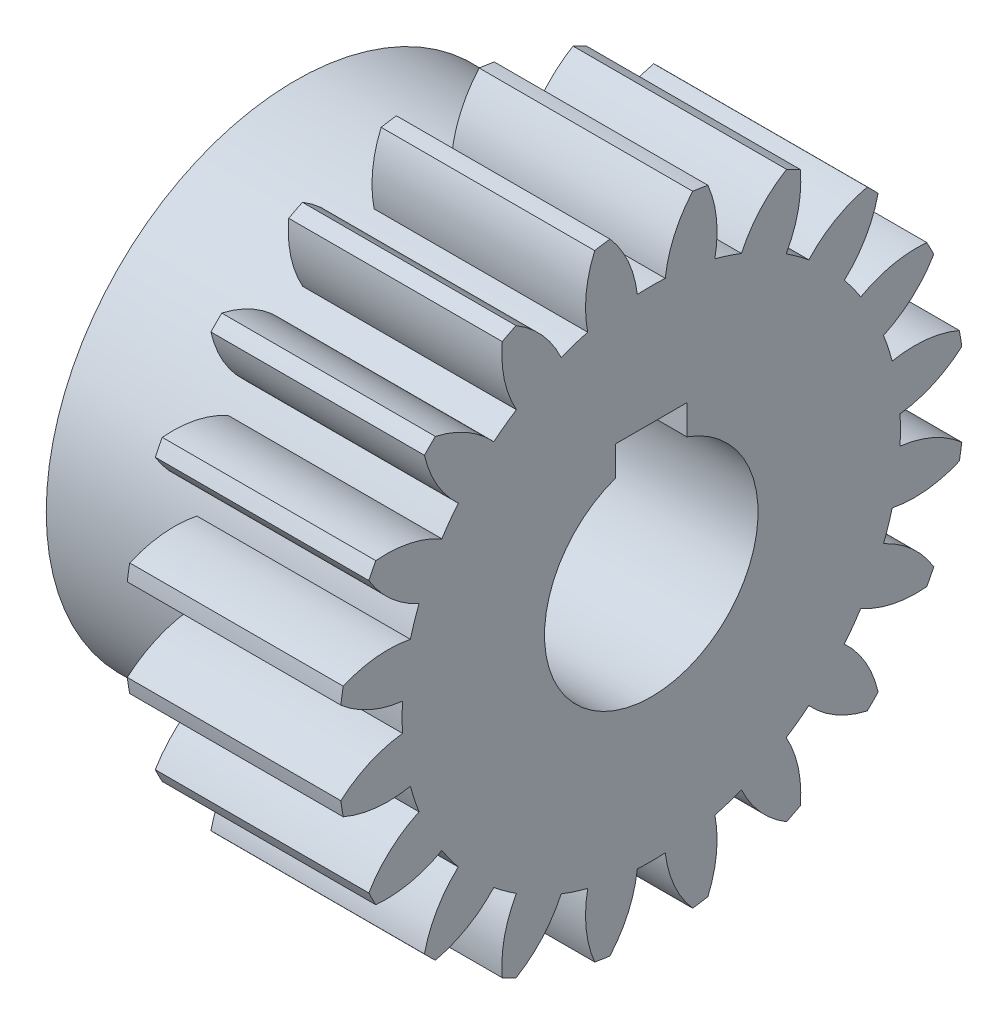
from build123d import *
from build123d.topology import SkipClean

# Parameters (mm, degrees)
BASPROSKE_W      = 30
BASPROSKE_H      = 44
TOOTHCUT_DEPTH   = 70.079664157
TEETHCUTS_COUNT  = 20
TEETHCUTS_ANGLE  = 342
HUBNEARONE_START = 20.0000508
HUBNEAONESKE_R   = 34.999
HUBNEARONE_DEPTH = 20.0000508
BORSKE_R         = 15
BORE_DEPTH       = 50.0000508
KEYSKE_W         = 10
KEYSKE_H         = 18.3
KEYWAY_DEPTH     = 50.0000508


with BuildPart() as part:
    # BasProSke → Base-Revolve (revolve)
    with BuildSketch(Plane(origin=(0, 0, 0), x_dir=(1, 0, 0), z_dir=(0, 1, 0)), mode=Mode.PRIVATE) as base_revolve_sk:
        with Locations((15, 22)):
            Rectangle(BASPROSKE_W, BASPROSKE_H)
    revolve(base_revolve_sk.sketch.rotate(Axis((-10, 0, 0), (1, 0, 0)), 180), axis=Axis((-10, 0, 0), (1, 0, 0)))

    # TooCutSke → ToothCut (cut, through all)
    with BuildSketch(Plane(origin=(0, 0, 0), x_dir=(0, 0, -1), z_dir=(1, 0, 0))):
        with BuildLine():
            ThreePointArc((1.961730392, 34.943978235), (0, 34.999), (-1.961730392, 34.943978235))
            ThreePointArc((-1.961730392, 34.943978235), (-3.235659864, 39.585086827), (-5.832115241, 43.637395396))
            ThreePointArc((-5.832115241, 43.637395396), (0, 44.0254), (5.832115241, 43.637395396))
            ThreePointArc((5.832115241, 43.637395396), (3.235659864, 39.585086827), (1.961730392, 34.943978235))
        make_face()
    toothcut = extrude(amount=TOOTHCUT_DEPTH, mode=Mode.SUBTRACT)

    # TeethCuts: ToothCut ×20 about axis
    teethcuts_axis = Axis((-10, 0, 0), (1, 0, 0))
    for i in range(1, TEETHCUTS_COUNT):
        add(toothcut.rotate(teethcuts_axis, i * TEETHCUTS_ANGLE / (TEETHCUTS_COUNT - 1)), mode=Mode.SUBTRACT)

    # HubNeaOneSke → HubNearOne (add)
    with SkipClean():  # the faces are left unmerged after this step: merging them gives an invalid solid
        with BuildSketch(Plane.ZY.offset(HUBNEARONE_START)):
            Circle(HUBNEAONESKE_R)
        extrude(amount=-HUBNEARONE_DEPTH)

    # BorSke → Bore (cut, symmetric)
    with SkipClean():  # the faces are left unmerged after this step: merging them gives an invalid solid
        with BuildSketch(Plane(origin=(0, 0, 0), x_dir=(0, 0, -1), z_dir=(1, 0, 0))):
            with Locations(Location((0, 0, 0), (0, 0, 180))):
                Circle(BORSKE_R)
        extrude(amount=BORE_DEPTH, both=True, mode=Mode.SUBTRACT)

    # KeySke → Keyway (cut, symmetric)
    with SkipClean():  # the faces are left unmerged after this step: merging them gives an invalid solid
        with BuildSketch(Plane(origin=(0, 0, 0), x_dir=(0, 0, -1), z_dir=(1, 0, 0))):
            with Locations((0, 9.15)):
                Rectangle(KEYSKE_W, KEYSKE_H)
        extrude(amount=KEYWAY_DEPTH, both=True, mode=Mode.SUBTRACT)


solid = part.part
